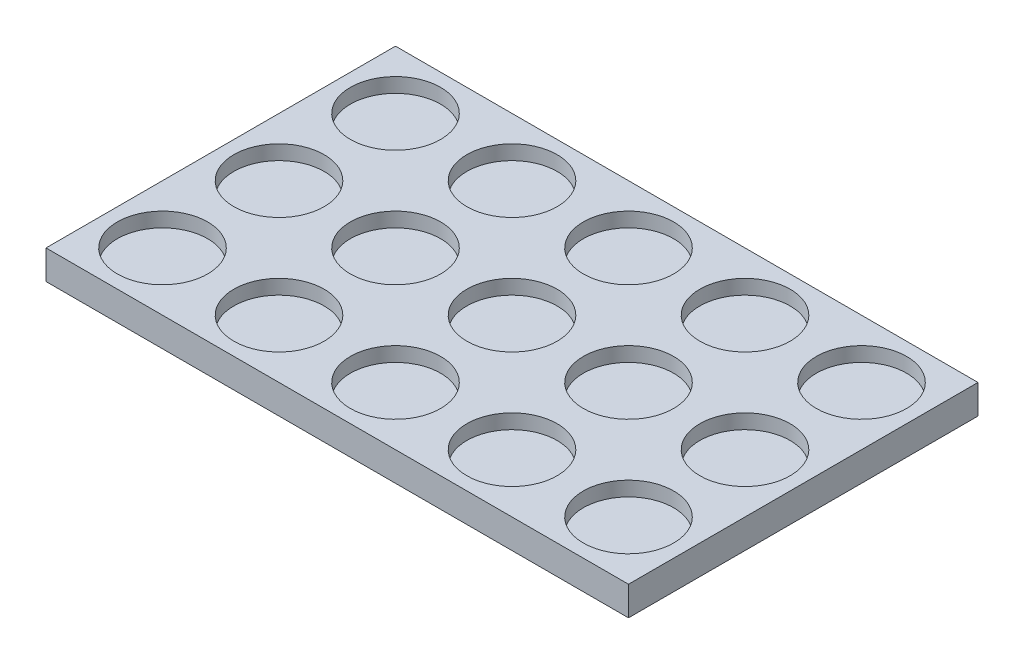
from build123d import *

# Parameters (mm, degrees)
SKETCH1_W            = 508
SKETCH1_H            = 304.8
BOSS_EXTRUDE1_DEPTH  = 25.4
SKETCH2_R            = 39.37
CUT_EXTRUDE1_DEPTH   = 12.7
LPATTERN1_COUNT      = 5
LPATTERN1_PITCH      = 101.6
LPATTERN1_COUNT_DIR2 = 3
LPATTERN1_PITCH_DIR2 = 101.6


with BuildPart() as part:
    # Sketch1 → Boss-Extrude1 (new body)
    with BuildSketch(Plane(origin=(0, 0, 0), x_dir=(1, 0, 0), z_dir=(0, 1, 0))):
        Rectangle(SKETCH1_W, SKETCH1_H)
    extrude(amount=BOSS_EXTRUDE1_DEPTH)

    # Sketch2 → Cut-Extrude1 (cut)
    with BuildSketch(Plane(origin=(0, 25.4, 0), x_dir=(1, 0, 0), z_dir=(0, 1, 0))):
        with Locations(Location((-203.2, -101.6, 0), (0, 0, 270))):
            Circle(SKETCH2_R)
    cut_extrude1 = extrude(amount=-CUT_EXTRUDE1_DEPTH, mode=Mode.SUBTRACT)

    # LPattern1: Cut-Extrude1 5 × 3
    with Locations(*[(i * LPATTERN1_PITCH, 0, -j * LPATTERN1_PITCH_DIR2) for i in range(LPATTERN1_COUNT) for j in range(LPATTERN1_COUNT_DIR2) if (i, j) != (0, 0)]):
        add(cut_extrude1, mode=Mode.SUBTRACT)


solid = part.part
